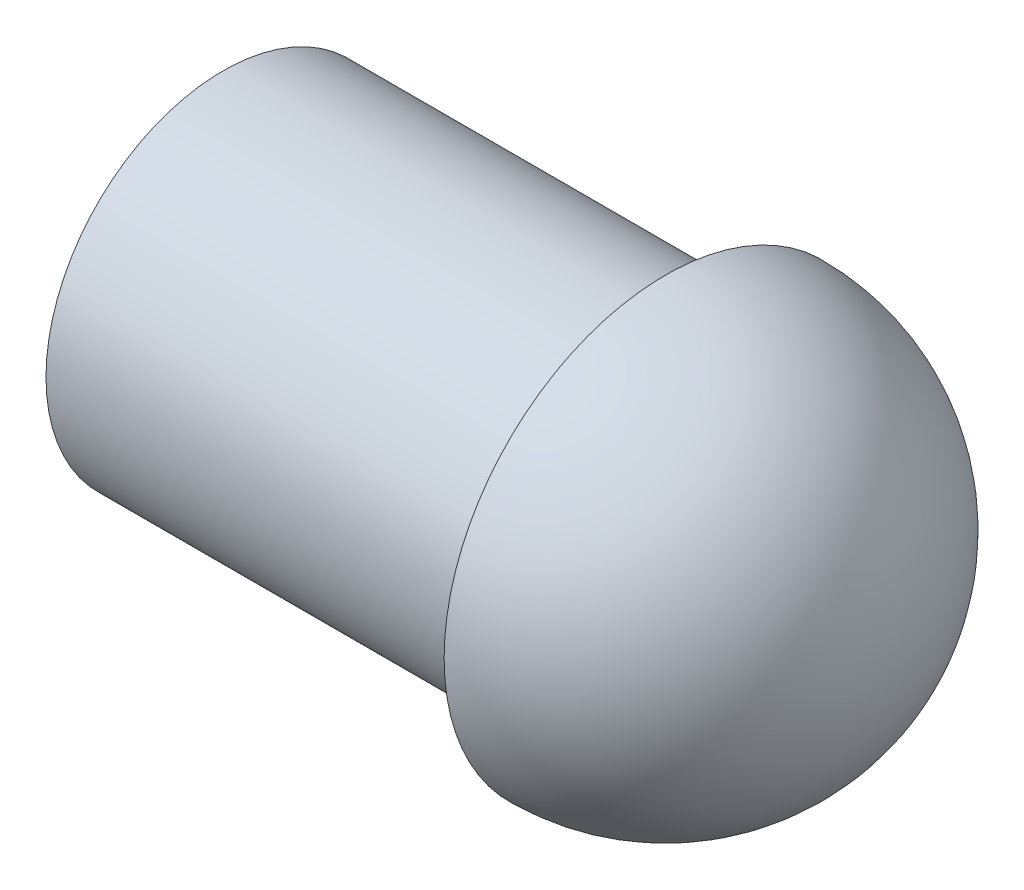
from build123d import *

# Parameters (mm, degrees)
REVOLVE_1_ANGLE = 180
SKETCH_2_R      = 10
SKETCH_2_R_2    = 2.5
EXTRUDE_1_DEPTH = 25


with BuildPart() as part:
    # 草圖1 → 旋轉1 (revolve)
    with BuildSketch(Plane(origin=(0, 0, 0), x_dir=(0, 0, -1), z_dir=(1, 0, 0))):
        with BuildLine():
            Line((0, 25), (0, 0))
            ThreePointArc((0, 0), (12.5, 12.5), (0, 25))
        make_face()
    revolve(axis=Axis((0, 25, 0), (0, -1, 0)), revolution_arc=REVOLVE_1_ANGLE)

    # 草圖2 → 填料-伸長1 (add)
    with BuildSketch(Plane.ZY):
        with Locations(Location((0, 12.5, 0), (0, 0, 180))):
            Circle(SKETCH_2_R)
        with Locations((0, 12.5)):
            Circle(SKETCH_2_R_2, mode=Mode.SUBTRACT)
    extrude(amount=EXTRUDE_1_DEPTH)


solid = part.part
